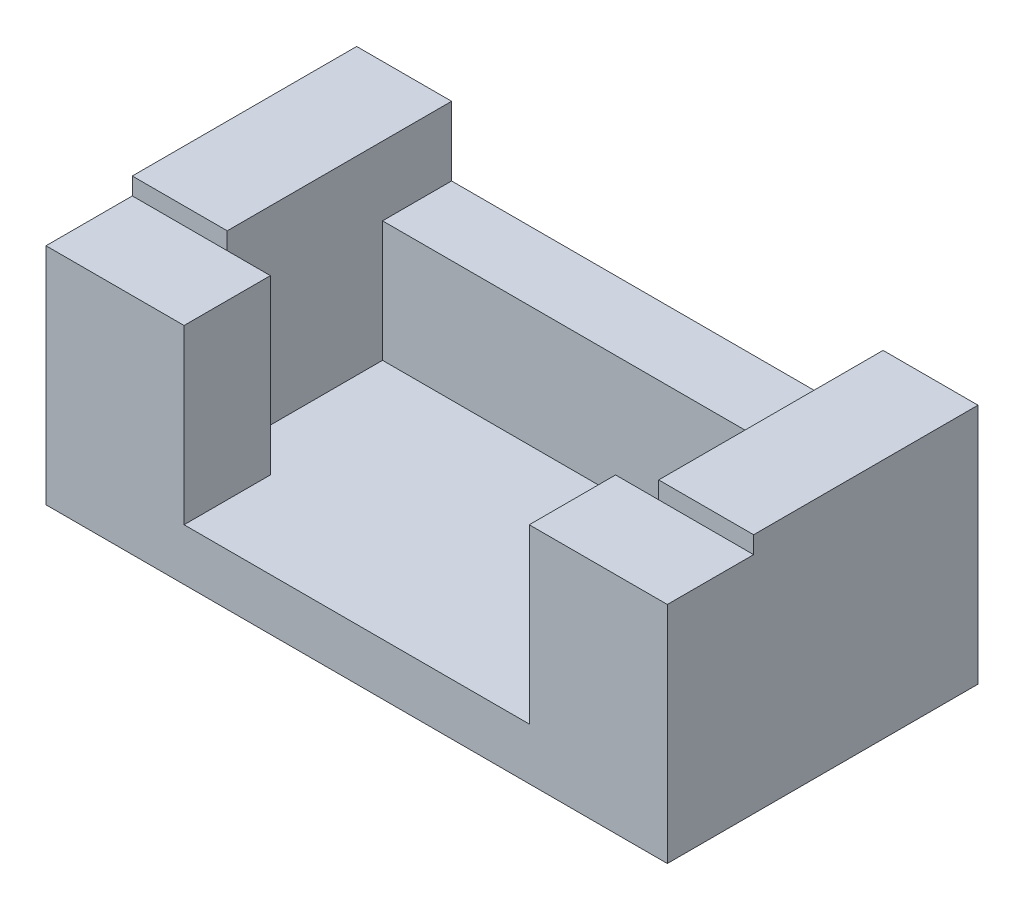
from build123d import *

# Parameters (mm, degrees)
SKETCH_1_W          = 36
SKETCH_1_H          = 18
EXTRUDE_1_DEPTH     = 3
SKETCH_2_W          = 8
SKETCH_2_H          = 5
EXTRUDE_2_DEPTH     = 10
EXTRUDE_3_DEPTH     = 11
SKETCH_4_W          = 25
SKETCH_4_H          = 4
CUT_EXTRUDE_1_DEPTH = 4


with BuildPart() as part:
    # 草图1 → 凸台-拉伸1 (new body)
    with BuildSketch(Plane(origin=(0, 0, 0), x_dir=(1, 0, 0), z_dir=(0, 1, 0))):
        Rectangle(SKETCH_1_W, SKETCH_1_H)
    extrude(amount=EXTRUDE_1_DEPTH)

    # 草图2 → 凸台-拉伸2 (add)
    with BuildSketch(Plane(origin=(0, 3, 0), x_dir=(1, 0, 0), z_dir=(0, 1, 0))):
        with Locations((-14, -6.5)):
            Rectangle(SKETCH_2_W, SKETCH_2_H)
        with Locations((14, -6.5)):
            Rectangle(SKETCH_2_W, SKETCH_2_H)
    extrude(amount=EXTRUDE_2_DEPTH)

    # 草图3 → 凸台-拉伸3 (add)
    with BuildSketch(Plane(origin=(0, 3, 0), x_dir=(1, 0, 0), z_dir=(0, 1, 0))):
        Polygon((-18, 9), (-18, -4), (-12.5, -4), (-12.5, 5), (12.5, 5), (12.5, -4), (18, -4), (18, 9), align=None)
    extrude(amount=EXTRUDE_3_DEPTH)

    # 草图4 → 切除-拉伸1 (cut)
    with BuildSketch(Plane(origin=(0, 14, 0), x_dir=(1, 0, 0), z_dir=(0, 1, 0))):
        with Locations((0, 7)):
            Rectangle(SKETCH_4_W, SKETCH_4_H)
    extrude(amount=-CUT_EXTRUDE_1_DEPTH, mode=Mode.SUBTRACT)


solid = part.part
